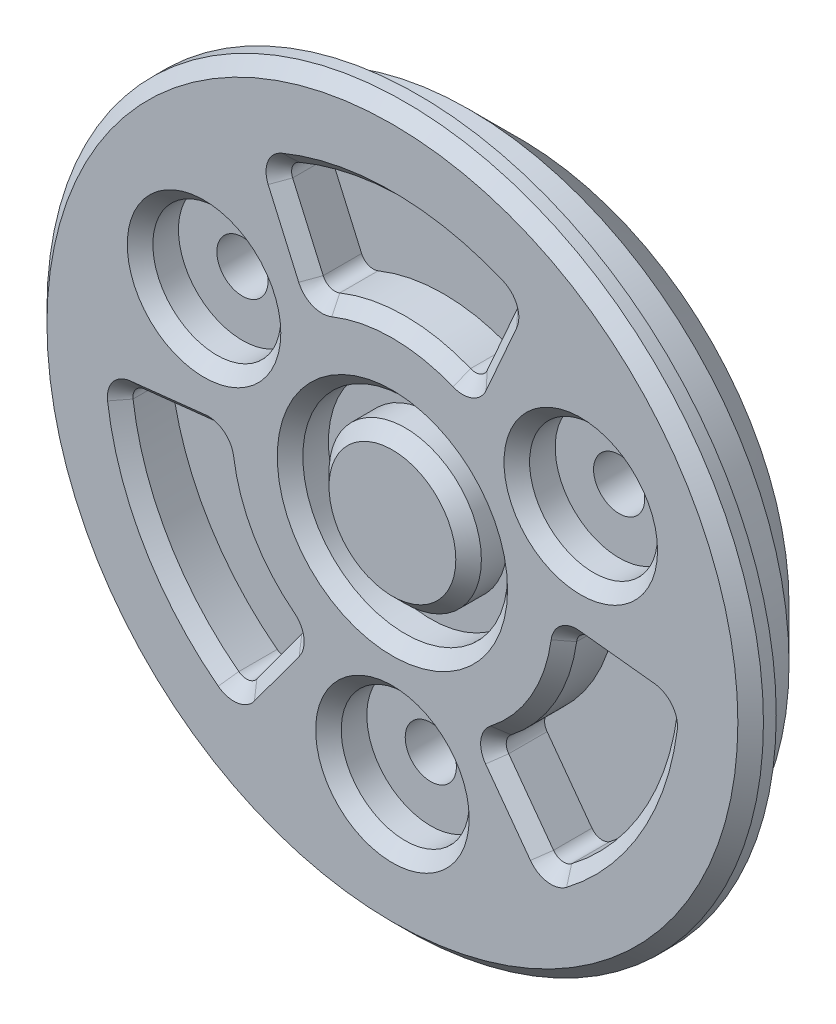
from build123d import *

# Parameters (mm, degrees)
SKETCH_4_R          = 12.5
EXTRUDE_1_DEPTH     = 4
SKETCH_5_R          = 2.5
CUT_EXTRUDE_1_DEPTH = 3
SKETCH_6_R          = 14
EXTRUDE_2_DEPTH     = 1
SKETCH_7_R          = 1
CUT_EXTRUDE_2_DEPTH = 2
SKETCH_11_R         = 1
CUT_EXTRUDE_5_DEPTH = 23.797075308
SKETCH_13_R         = 4
SKETCH_13_R_2       = 2.977192395
SKETCH_13_R_3       = 2.5
CUT_EXTRUDE_6_DEPTH = 1.5
CUT_EXTRUDE_7_DEPTH = 2
CHAMFER_2_SIZE      = 0.5
CHAMFER_1_SIZE      = 2
SKETCH_16_R         = 3.5
CUT_EXTRUDE_8_DEPTH = 0.5


with BuildPart() as part:
    # 草图4 → 凸台-拉伸1 (new body)
    with BuildSketch(Plane.XY.offset(20.116672725)):
        with Locations((0.173765051, -3.140916746)):
            Circle(SKETCH_4_R)
    extrude(amount=-EXTRUDE_1_DEPTH)

    # 草图5 → 切除-拉伸1 (cut)
    with BuildSketch(Plane(origin=(0, 0, 16.116672725), x_dir=(-1, 0, 0), z_dir=(0, 0, -1))):
        with Locations((-0.173765051, -3.140916746)):
            Circle(SKETCH_5_R)
    extrude(amount=-CUT_EXTRUDE_1_DEPTH, mode=Mode.SUBTRACT)

    # 草图6 → 凸台-拉伸2 (add)
    with BuildSketch(Plane.XY.offset(20.116672725)):
        with Locations((0.173765051, -3.140916746)):
            Circle(SKETCH_6_R)
    extrude(amount=EXTRUDE_2_DEPTH)

    # 草图7 → 切除-拉伸2 (cut)
    with BuildSketch(Plane(origin=(0, 0, 16.116672725), x_dir=(-1, 0, 0), z_dir=(0, 0, -1))):
        with Locations((-0.173765051, 5.359083254)):
            Circle(SKETCH_7_R)
        with Locations((7.187450882, 1.109083254)):
            Circle(SKETCH_7_R)
        with Locations((7.187450882, -7.390916746)):
            Circle(SKETCH_7_R)
        with Locations((-0.173765051, -11.640916746)):
            Circle(SKETCH_7_R)
        with Locations((-7.534980983, -7.390916746)):
            Circle(SKETCH_7_R)
        with Locations((-7.534980983, 1.109083254)):
            Circle(SKETCH_7_R)
    extrude(amount=-CUT_EXTRUDE_2_DEPTH, mode=Mode.SUBTRACT)

    # 草图11 → 切除-拉伸5 (cut, through all)
    with BuildSketch(Plane.XY.offset(21.116672725)):
        with Locations(Location((0.173765051, -11.640916746, 0), (0, 0, 180))):
            Circle(SKETCH_11_R)
        with Locations(Location((-7.187450882, 1.109083254, 0), (0, 0, 180))):
            Circle(SKETCH_11_R)
        with Locations(Location((7.534980983, 1.109083254, 0), (0, 0, 180))):
            Circle(SKETCH_11_R)
    extrude(amount=-CUT_EXTRUDE_5_DEPTH, mode=Mode.SUBTRACT)

    # 草图13 → 切除-拉伸6 (cut)
    # profile 1 of 4: a face of its own
    with BuildSketch(Plane.XY.offset(21.116672725)):
        with Locations((0.173765051, -3.140916746)):
            Circle(SKETCH_13_R)
        with Locations((0.173765051, -3.140916746)):
            Circle(SKETCH_13_R_2, mode=Mode.SUBTRACT)
    # profile 2 of 4: a face of its own
    with BuildSketch(Plane.XY.offset(21.116672725)):
        with Locations((0.173765051, -11.640916746)):
            Circle(SKETCH_13_R_3)
    # profile 3 of 4: a face of its own
    with BuildSketch(Plane.XY.offset(21.116672725)):
        with Locations((-7.187450882, 1.109083254)):
            Circle(SKETCH_13_R_3)
    # profile 4 of 4: a face of its own
    with BuildSketch(Plane.XY.offset(21.116672725)):
        with Locations((7.534980983, 1.109083254)):
            Circle(SKETCH_13_R_3)
    extrude(amount=-CUT_EXTRUDE_6_DEPTH, mode=Mode.SUBTRACT)

    # 草图15 → 切除-拉伸7 (cut)
    with BuildSketch(Plane.XY.offset(21.116672725)):
        with BuildLine():
            Line((-5.622832862, -11.565446955), (-3.870986227, -9.176206785))
            ThreePointArc((-3.870986227, -9.176206785), (-3.779061338, -8.81107053), (-3.967934532, -8.485338144))
            ThreePointArc((-3.967934532, -8.485338144), (-5.681778189, -6.521616212), (-6.52548944, -4.0555231))
            ThreePointArc((-6.52548944, -4.0555231), (-6.713145364, -3.729087923), (-7.075325081, -3.626129085))
            Line((-7.075325081, -3.626129085), (-10.020391082, -3.94865269))
            ThreePointArc((-10.020391082, -3.94865269), (-10.358840265, -4.136415806), (-10.461871079, -4.509494201))
            ThreePointArc((-10.461871079, -4.509494201), (-9.112909279, -8.50258067), (-6.329275857, -11.667359093))
            ThreePointArc((-6.329275857, -11.667359093), (-5.954665083, -11.764670987), (-5.622832862, -11.565446955))
        make_face()
        with BuildLine():
            Line((-4.223793169, 6.091349407), (-3.030573803, 3.379585632))
            ThreePointArc((-3.030573803, 3.379585632), (-2.760318975, 3.117408215), (-2.383789858, 3.118111006))
            ThreePointArc((-2.383789858, 3.118111006), (0.173765051, 3.620482186), (2.731319959, 3.118111006))
            ThreePointArc((2.731319959, 3.118111006), (3.107849076, 3.117408215), (3.378103905, 3.379585632))
            Line((3.378103905, 3.379585632), (4.57132327, 6.091349407))
            ThreePointArc((4.57132327, 6.091349407), (4.577940233, 6.478336555), (4.306360273, 6.754103056))
            ThreePointArc((4.306360273, 6.754103056), (0.173765051, 7.582411102), (-3.958830172, 6.754103056))
            ThreePointArc((-3.958830172, 6.754103056), (-4.230410131, 6.478336555), (-4.223793169, 6.091349407))
        make_face()
        with BuildLine():
            Line((10.367921183, -3.94865269), (7.422855183, -3.626129085))
            ThreePointArc((7.422855183, -3.626129085), (7.060675465, -3.729087923), (6.873019541, -4.0555231))
            ThreePointArc((6.873019541, -4.0555231), (6.02930829, -6.521616212), (4.315464633, -8.485338144))
            ThreePointArc((4.315464633, -8.485338144), (4.126591439, -8.81107053), (4.218516329, -9.176206785))
            Line((4.218516329, -9.176206785), (5.970362964, -11.565446955))
            ThreePointArc((5.970362964, -11.565446955), (6.302195184, -11.764670987), (6.676805959, -11.667359093))
            ThreePointArc((6.676805959, -11.667359093), (9.46043938, -8.50258067), (10.809401181, -4.509494201))
            ThreePointArc((10.809401181, -4.509494201), (10.706370366, -4.136415806), (10.367921183, -3.94865269))
        make_face()
    extrude(amount=-CUT_EXTRUDE_7_DEPTH, mode=Mode.SUBTRACT)

    # 倒角2
    chamfer_2_edges = [part.edges().sort_by_distance(p)[0] for p in [
        (-13.826234949, -3.140916746, 21.116672725),
        (-2.760318975, 3.117408215, 21.116672725),
        (0.173765051, 3.620482186, 21.116672725),
        (3.107849076, 3.117408215, 21.116672725),
        (3.974713587, 4.73546752, 21.116672725),
        (4.577940233, 6.478336555, 21.116672725),
        (0.173765051, 7.582411102, 21.116672725),
        (-4.230410131, 6.478336555, 21.116672725),
        (-3.627183486, 4.73546752, 21.116672725),
        (-3.779061338, -8.81107053, 21.116672725),
        (-5.681778189, -6.521616212, 21.116672725),
        (-6.713145364, -3.729087923, 21.116672725),
        (-8.547858082, -3.787390887, 21.116672725),
        (-10.358840265, -4.136415806, 21.116672725),
        (-9.112909279, -8.50258067, 21.116672725),
        (-5.954665083, -11.764670987, 21.116672725),
        (-4.746909545, -10.37082687, 21.116672725),
        (5.034980983, 1.109083254, 21.116672725),
        (-9.687450882, 1.109083254, 21.116672725),
        (-2.326234949, -11.640916746, 21.116672725),
        (-3.826234949, -3.140916746, 21.116672725),
        (-2.803427344, -3.140916746, 21.116672725),
        (7.060675465, -3.729087923, 21.116672725),
        (6.02930829, -6.521616212, 21.116672725),
        (4.126591439, -8.81107053, 21.116672725),
        (5.094439646, -10.37082687, 21.116672725),
        (6.302195184, -11.764670987, 21.116672725),
        (9.46043938, -8.50258067, 21.116672725),
        (10.706370366, -4.136415806, 21.116672725),
        (8.895388183, -3.787390887, 21.116672725),
    ]]
    chamfer(chamfer_2_edges, length=CHAMFER_2_SIZE)

    # Chamfer 1
    chamfer_1_edges = [part.edges().sort_by_distance(p)[0] for p in [
        (-12.326234949, -3.140916746, 16.116672725),
    ]]
    chamfer(chamfer_1_edges, length=CHAMFER_1_SIZE)

    # 草图16 → 切除-拉伸8 (cut)
    with BuildSketch(Plane(origin=(0, 0, 16.116672725), x_dir=(-1, 0, 0), z_dir=(0, 0, -1))):
        with Locations((-0.173765051, -3.140916746)):
            Circle(SKETCH_16_R)
    extrude(amount=-CUT_EXTRUDE_8_DEPTH, mode=Mode.SUBTRACT)


solid = part.part
